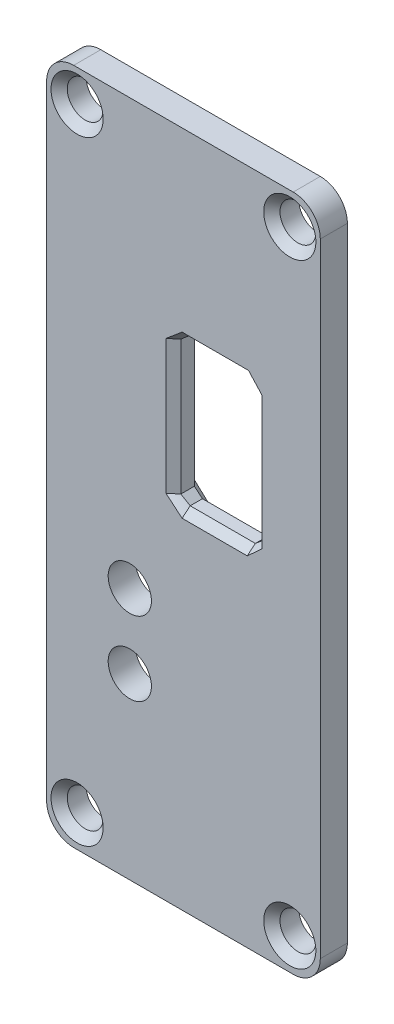
from build123d import *
from OCP.BRepFilletAPI import BRepFilletAPI_MakeChamfer

# Parameters (mm, degrees)
SKETCH_1_W      = 20.2
SKETCH_1_H      = 50
SKETCH_1_R      = 1.325
SKETCH_1_R_2    = 1.595
SKETCH_1_W_2    = 6
SKETCH_1_H_2    = 10.9
EXTRUDE_1_DEPTH = 2
FILLET_1_R      = 2
CHAMFER_1_SIZE  = 0.6
CHAMFER_2_SIZE  = 0.5
CHAMFER_2_SIZE2 = 0.595876796


with BuildPart() as part:
    # 草图1 → 凸台-拉伸1 (new body)
    with BuildSketch(Plane.XY):
        with Locations((-6.4, 0)):
            Rectangle(SKETCH_1_W, SKETCH_1_H)
        with Locations((-14.25, -22.65)):
            Circle(SKETCH_1_R, mode=Mode.SUBTRACT)
        with Locations((-14.25, 22.65)):
            Circle(SKETCH_1_R, mode=Mode.SUBTRACT)
        with Locations((1.45, 22.65)):
            Circle(SKETCH_1_R, mode=Mode.SUBTRACT)
        with Locations((1.45, -22.65)):
            Circle(SKETCH_1_R, mode=Mode.SUBTRACT)
        with Locations((-10.36, -6.365)):
            Circle(SKETCH_1_R_2, mode=Mode.SUBTRACT)
        with Locations((-10.36, -11.8216)):
            Circle(SKETCH_1_R_2, mode=Mode.SUBTRACT)
        with Locations((-4.095, 6)):
            Rectangle(SKETCH_1_W_2, SKETCH_1_H_2, mode=Mode.SUBTRACT)
    extrude(amount=EXTRUDE_1_DEPTH)

    # 圆角1
    fillet_1_edges = [part.edges().sort_by_distance(p)[0] for p in [
        (-16.5, 25, 1),
        (3.7, 25, 1),
        (3.7, -25, 1),
        (-16.5, -25, 1),
    ]]
    fillet(fillet_1_edges, radius=FILLET_1_R)

    # 倒角1
    chamfer_1_edges = [part.edges().sort_by_distance(p)[0] for p in [
        (-15.575, -22.65, 2),
        (-15.575, 22.65, 2),
        (0.125, 22.65, 2),
        (0.125, -22.65, 2),
    ]]
    chamfer(chamfer_1_edges, length=CHAMFER_1_SIZE)

    # 倒角2: one chamfer whose edges measure the first distance from different faces: ONE call of the kernel's chamfer builder (chamfer() names one face for all edges)
    chamfer_2_edges_1 = [part.edges().sort_by_distance(p)[0] for p in [
        (-7.095, 6, 0),
        (-7.095, 11.45, 1),
        (-7.095, 0.55, 1),
        (-7.095, 6, 2),
    ]]
    chamfer_2_side_1 = [part.faces().sort_by_distance(p)[0] for p in [
        (-7.095, 6, 1),
    ]]
    chamfer_2_edges_2 = [part.edges().sort_by_distance(p)[0] for p in [
        (-4.095, 0.55, 0),
    ]]
    chamfer_2_side_2 = [part.faces().sort_by_distance(p)[0] for p in [
        (-4.095, 0.55, 1),
    ]]
    chamfer_2_edges_3 = [part.edges().sort_by_distance(p)[0] for p in [
        (-1.095, 6, 0),
        (-1.095, 0.55, 1),
    ]]
    chamfer_2_side_3 = [part.faces().sort_by_distance(p)[0] for p in [
        (-1.095, 6, 1),
    ]]
    chamfer_2_edges_4 = [part.edges().sort_by_distance(p)[0] for p in [
        (-4.095, 11.45, 0),
        (-1.095, 11.45, 1),
    ]]
    chamfer_2_side_4 = [part.faces().sort_by_distance(p)[0] for p in [
        (-4.095, 11.45, 1),
    ]]
    chamfer_2_edges_5 = [part.edges().sort_by_distance(p)[0] for p in [
        (-4.095, 0.55, 2),
        (-1.095, 6, 2),
        (-4.095, 11.45, 2),
    ]]
    chamfer_2_side_5 = [part.faces().sort_by_distance(p)[0] for p in [
        (-6.499529382, -0.281178063, 2),
    ]]
    chamfer_2 = BRepFilletAPI_MakeChamfer(part.part.solid().wrapped)
    for e in chamfer_2_edges_1:
        chamfer_2.Add(CHAMFER_2_SIZE, CHAMFER_2_SIZE2, e.wrapped, chamfer_2_side_1[0].wrapped)  # the first distance lies on this face
    for e in chamfer_2_edges_2:
        chamfer_2.Add(CHAMFER_2_SIZE, CHAMFER_2_SIZE2, e.wrapped, chamfer_2_side_2[0].wrapped)  # the first distance lies on this face
    for e in chamfer_2_edges_3:
        chamfer_2.Add(CHAMFER_2_SIZE, CHAMFER_2_SIZE2, e.wrapped, chamfer_2_side_3[0].wrapped)  # the first distance lies on this face
    for e in chamfer_2_edges_4:
        chamfer_2.Add(CHAMFER_2_SIZE, CHAMFER_2_SIZE2, e.wrapped, chamfer_2_side_4[0].wrapped)  # the first distance lies on this face
    for e in chamfer_2_edges_5:
        chamfer_2.Add(CHAMFER_2_SIZE, CHAMFER_2_SIZE2, e.wrapped, chamfer_2_side_5[0].wrapped)  # the first distance lies on this face
    add(Compound.cast(chamfer_2.Shape()), mode=Mode.REPLACE)


solid = part.part
